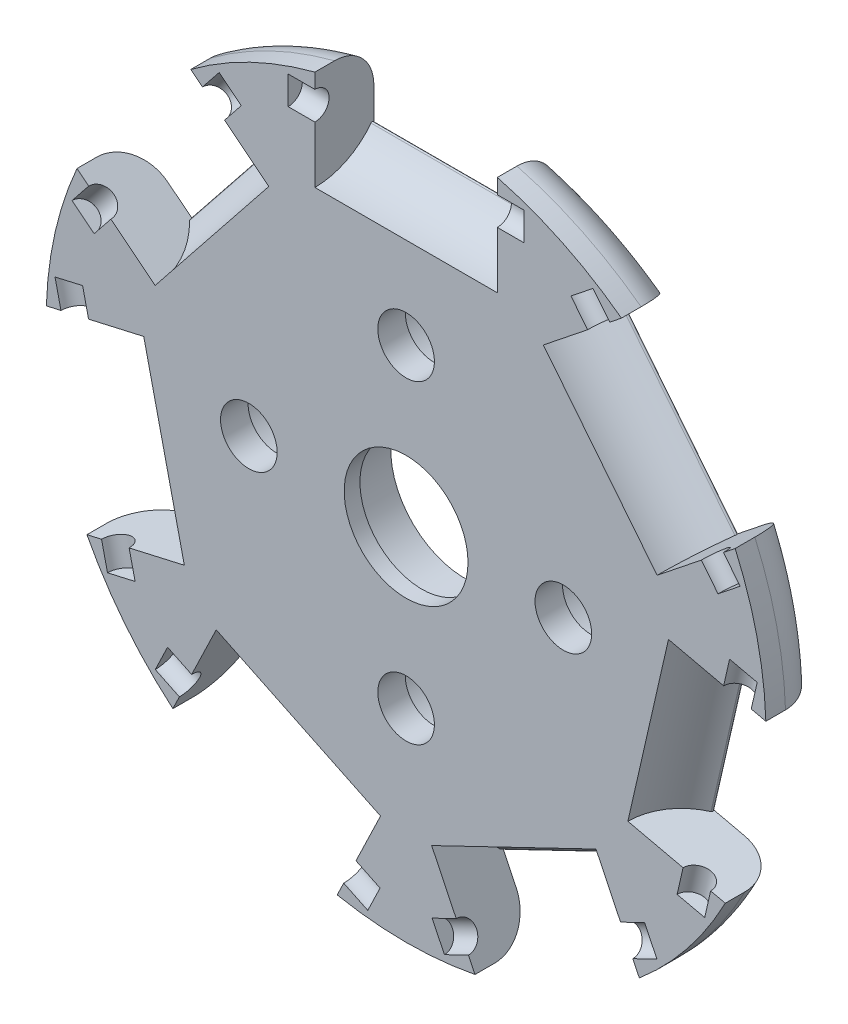
from build123d import *

# Parameters (mm, degrees)
SKETCH1_R                = 29.0703
BOSS_EXTRUDE2_DEPTH      = 4.7625
FILLET1_R                = 3.175
SKETCH2_W                = 14.732
SKETCH2_H                = 10.414
CUT_EXTRUDE2_DEPTH       = 12.7
CIRPATTERN1_COUNT        = 7
SKETCH4_R                = 1.143
CUT_EXTRUDE4_DEPTH       = 9.525
CIRPATTERN2_COUNT        = 7
SKETCH6_R                = 2.286
CUT_EXTRUDE7_DEPTH       = 42.376236281
SKETCH7_R                = 4.445
CUT_EXTRUDE8_DEPTH       = 2.54
BOSS_EXTRUDE4_REACH      = 48.843
FILLET2_R                = 0.127
CIRPATTERN5_COUNT        = 7
FILLET2_OF_CIRPATTERN5_R = 0.127
SKETCH5_R                = 6
CUT_EXTRUDE9_DEPTH       = 5.08
SKETCH11_R               = 6
SKETCH11_R_2             = 5
BOSS_EXTRUDE5_DEPTH      = 1.27


with BuildPart() as part:
    # Sketch1 → Boss-Extrude2 (new body)
    with BuildSketch(Plane.XY):
        Circle(SKETCH1_R)
    extrude(amount=-BOSS_EXTRUDE2_DEPTH)

    # Fillet1
    fillet1_edges = [part.edges().sort_by_distance(p)[0] for p in [
        (-29.0703, 0, -4.7625),
    ]]
    fillet(fillet1_edges, radius=FILLET1_R)

    # Sketch2 → Cut-Extrude2 (cut)
    with BuildSketch(Plane.XY):
        with Locations((0, 25.1333)):
            Rectangle(SKETCH2_W, SKETCH2_H)
    cut_extrude2 = extrude(amount=-CUT_EXTRUDE2_DEPTH, mode=Mode.SUBTRACT)

    # CirPattern1: Cut-Extrude2 ×7 about axis
    cirpattern1_axis = Axis((0, 0, 0), (0, 0, 1))
    for i in range(1, CIRPATTERN1_COUNT):
        add(cut_extrude2.rotate(cirpattern1_axis, i * 360 / CIRPATTERN1_COUNT), mode=Mode.SUBTRACT)

    # Sketch4 → Cut-Extrude4 (cut, symmetric)
    with BuildSketch(Plane(origin=(0, 0, 0), x_dir=(0, 0, -1), z_dir=(1, 0, 0))):
        with Locations((0, 25.7683)):
            Circle(SKETCH4_R)
    cut_extrude4 = extrude(amount=CUT_EXTRUDE4_DEPTH, both=True, mode=Mode.SUBTRACT)

    # CirPattern2: Cut-Extrude4 ×7 about axis
    cirpattern2_axis = Axis((0, 0, 0), (0, 0, 1))
    for i in range(1, CIRPATTERN2_COUNT):
        add(cut_extrude4.rotate(cirpattern2_axis, i * 360 / CIRPATTERN2_COUNT), mode=Mode.SUBTRACT)

    # Sketch6 → Cut-Extrude7 (cut, through all)
    with BuildSketch(Plane(origin=(0, 0, -4.7625), x_dir=(-1, 0, 0), z_dir=(0, 0, -1))):
        with Locations((12.7, 0)):
            Circle(SKETCH6_R)
        with Locations((0, -12.7)):
            Circle(SKETCH6_R)
        with Locations((-12.7, 0)):
            Circle(SKETCH6_R)
        with Locations((0, 12.7)):
            Circle(SKETCH6_R)
    extrude(amount=-CUT_EXTRUDE7_DEPTH, mode=Mode.SUBTRACT)

    # Sketch7 → Cut-Extrude8 (cut)
    with BuildSketch(Plane(origin=(0, 0, -4.7625), x_dir=(-1, 0, 0), z_dir=(0, 0, -1))):
        with Locations((12.7, 0)):
            Circle(SKETCH7_R)
        with Locations((0, -12.7)):
            Circle(SKETCH7_R)
        with Locations((-12.7, 0)):
            Circle(SKETCH7_R)
        with Locations((0, 12.7)):
            Circle(SKETCH7_R)
    extrude(amount=-CUT_EXTRUDE8_DEPTH, mode=Mode.SUBTRACT)

    # Sketch10 → Boss-Extrude4 (add, up to next)
    with BuildSketch(Plane.ZY.offset(-7.366), mode=Mode.PRIVATE) as boss_extrude4_sk1:
        with BuildLine():
            Line((-4.7625, 19.9263), (0, 19.9263))
            Line((0, 19.9263), (0, 20.0533))
            ThreePointArc((0, 20.0533), (-2.7025038, 20.73265722), (-4.7625, 22.609214887))
            Line((-4.7625, 22.609214887), (-4.7625, 19.9263))
        make_face()
    boss_extrude4_tool1 = extrude(boss_extrude4_sk1.sketch, amount=BOSS_EXTRUDE4_REACH, mode=Mode.PRIVATE) - part.part
    boss_extrude4 = boss_extrude4_tool1.solids().sort_by_distance((7.366, 20.664807, -3.452063))[0]
    add(boss_extrude4)

    # Fillet2
    fillet2_edges = [part.edges().sort_by_distance(p)[0] for p in [
        (0, 22.609214887, -4.7625),
    ]]
    fillet(fillet2_edges, radius=FILLET2_R)

    # CirPattern5: Boss-Extrude4 ×7 about axis
    cirpattern5_axis = Axis((0, 0, 0), (0, 0, 1))
    for i in range(1, CIRPATTERN5_COUNT):
        add(boss_extrude4.rotate(cirpattern5_axis, i * 360 / CIRPATTERN5_COUNT))

    # Fillet2 of CirPattern5
    fillet2_of_cirpattern5_edges = [part.edges().sort_by_distance(p)[0] for p in [
        (-17.676595993, 14.09661491, -4.7625),
        (-22.042354666, -5.031023613, -4.7625),
        (-9.809770694, -20.370198741, -4.7625),
        (9.809770694, -20.370198741, -4.7625),
        (22.042354666, -5.031023613, -4.7625),
        (17.676595993, 14.09661491, -4.7625),
    ]]
    fillet(fillet2_of_cirpattern5_edges, radius=FILLET2_OF_CIRPATTERN5_R)

    # Sketch5 → Cut-Extrude9 (cut)
    with BuildSketch(Plane.XY):
        Circle(SKETCH5_R)
    extrude(amount=-CUT_EXTRUDE9_DEPTH, mode=Mode.SUBTRACT)

    # Sketch11 → Boss-Extrude5 (add)
    with BuildSketch(Plane.XY):
        Circle(SKETCH11_R)
        Circle(SKETCH11_R_2, mode=Mode.SUBTRACT)
    extrude(amount=-BOSS_EXTRUDE5_DEPTH)


solid = part.part
